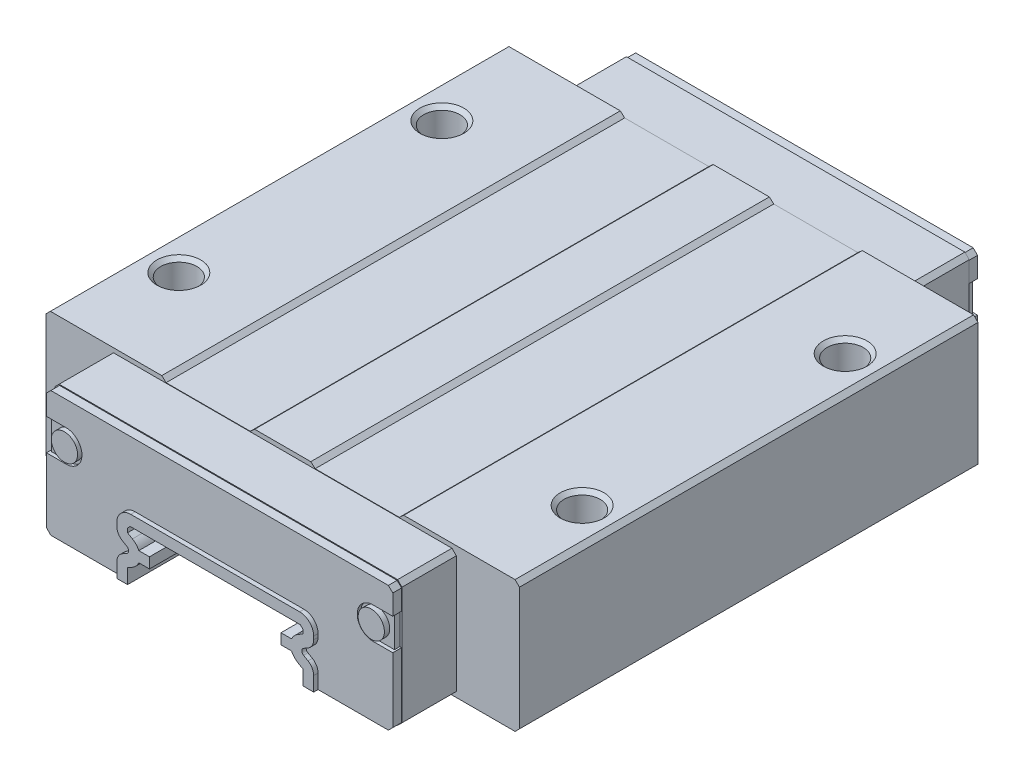
from build123d import *

# Parameters (mm, degrees)
BOSS_EXTRUDE1_DEPTH      = 26.15
BOSS_EXTRUDE1_DEPTH_BACK = 26.15
BOSS_EXTRUDE2_DEPTH      = 7.7
BOSS_EXTRUDE3_DEPTH      = 7.7
SKETCH4_W                = 108
SKETCH4_H                = 30
CUT_EXTRUDE1_DEPTH       = 1.5
SKETCH5_W                = 108
SKETCH5_H                = 30
CUT_EXTRUDE2_DEPTH       = 0.5
CUT_EXTRUDE3_START       = 1.5
SKETCH6_W                = 108
SKETCH6_H                = 30
CUT_EXTRUDE3_DEPTH       = 1.5
CUT_EXTRUDE4_START       = 0.5
SKETCH7_W                = 108
SKETCH7_H                = 30
CUT_EXTRUDE4_DEPTH       = 0.5
BOSS_EXTRUDE4_START      = 0.6
BOSS_EXTRUDE4_DEPTH      = 0.6
BOSS_EXTRUDE5_START      = 0.6
BOSS_EXTRUDE5_DEPTH      = 0.6
BOSS_EXTRUDE6_DEPTH      = 0.6
BOSS_EXTRUDE7_DEPTH      = 0.6
SKETCH12_W               = 0.6
SKETCH12_H               = 1.5
SKETCH13_W               = 0.6
SKETCH13_H               = 1.5
SKETCH14_W               = 0.6
SKETCH14_H               = 1.5
SKETCH15_W               = 0.6
SKETCH15_H               = 1.5
CUT_EXTRUDE5_DEPTH       = 26.15
CUT_EXTRUDE5_DEPTH_BACK  = 26.15
CUT_EXTRUDE6_DEPTH       = 26.15
SKETCH18_W               = 108
SKETCH18_H               = 30
CUT_EXTRUDE7_DEPTH       = 0.05
CUT_EXTRUDE8_START       = -26.15
CUT_EXTRUDE8_DEPTH       = 26.15
CUT_EXTRUDE9_START       = -0.05
SKETCH20_W               = 108
SKETCH20_H               = 30
CUT_EXTRUDE9_DEPTH       = 0.05


with BuildPart() as part:
    # Sketch1 → Boss-Extrude1 (new, two sides: drawn at the far end of the back side and taken through both)
    with BuildSketch(Plane.XY.offset(-BOSS_EXTRUDE1_DEPTH_BACK)):
        Polygon((-27, 19.5), (-27, 5.5), (-26.5, 5), (-14.47225, 5), (-14.257799308, 5.1), (14.257799308, 5.1), (14.47225, 5), (26.5, 5), (27, 5.5), (27, 19.5), (26.5, 20), (13.8, 20), (13.3, 19.55), (3.7, 19.55), (3.2, 20), (-3.2, 20), (-3.7, 19.55), (-13.3, 19.55), (-13.8, 20), (-26.5, 20), align=None)
    extrude(amount=BOSS_EXTRUDE1_DEPTH + BOSS_EXTRUDE1_DEPTH_BACK)

    # Sketch2 → Boss-Extrude2 (add)
    with BuildSketch(Plane.XY.offset(26.15)):
        Polygon((-19.8, 5.6), (-19.3, 5.1), (19.3, 5.1), (19.8, 5.6), (19.8, 19), (19.3, 19.5), (-19.3, 19.5), (-19.8, 19), align=None)
    extrude(amount=BOSS_EXTRUDE2_DEPTH)

    # Sketch3 → Boss-Extrude3 (add)
    with BuildSketch(Plane.XY.offset(-26.15)):
        Polygon((-19.8, 5.6), (-19.3, 5.1), (19.3, 5.1), (19.8, 5.6), (19.8, 19), (19.3, 19.5), (-19.3, 19.5), (-19.8, 19), align=None)
    extrude(amount=-BOSS_EXTRUDE3_DEPTH)

    # Sketch4 → Cut-Extrude1 (cut)
    with BuildSketch(Plane.XY.offset(33.85)):
        with Locations((0, 15)):
            Rectangle(SKETCH4_W, SKETCH4_H)
        with BuildLine():
            Line((-19.75, 5.6), (-19.25, 5.1))
            Line((-19.25, 5.1), (19.25, 5.1))
            Line((19.25, 5.1), (19.75, 5.6))
            Line((19.75, 5.6), (19.75, 13))
            Line((19.75, 13), (17.5, 13))
            ThreePointArc((17.5, 13), (15.7, 14.8), (17.5, 16.6))
            Line((17.5, 16.6), (19.75, 16.6))
            Line((19.75, 16.6), (19.75, 18.9))
            Line((19.75, 18.9), (19.25, 19.4))
            Line((19.25, 19.4), (-19.25, 19.4))
            Line((-19.25, 19.4), (-19.75, 18.9))
            Line((-19.75, 18.9), (-19.75, 16.6))
            Line((-19.75, 16.6), (-17.5, 16.6))
            ThreePointArc((-17.5, 16.6), (-15.7, 14.8), (-17.5, 13))
            Line((-17.5, 13), (-19.75, 13))
            Line((-19.75, 13), (-19.75, 5.6))
        make_face(mode=Mode.SUBTRACT)
    extrude(amount=-CUT_EXTRUDE1_DEPTH, mode=Mode.SUBTRACT)

    # Sketch5 → Cut-Extrude2 (cut)
    with BuildSketch(Plane.XY.offset(33.85)):
        with Locations((0, 15)):
            Rectangle(SKETCH5_W, SKETCH5_H)
        with BuildLine():
            Line((-11.23, 5.1), (11.23, 5.1))
            Line((11.23, 5.1), (11.23, 6.7357))
            ThreePointArc((11.23, 6.7357), (11.055848949, 7.385672418), (10.580055163, 7.861501175))
            Line((10.580055163, 7.861501175), (10.074183027, 8.153599638))
            ThreePointArc((10.074183027, 8.153599638), (9.8742, 8.5), (10.074183027, 8.846400362))
            Line((10.074183027, 8.846400362), (10.580055163, 9.138498825))
            ThreePointArc((10.580055163, 9.138498825), (11.055848949, 9.614327582), (11.23, 10.2643))
            Line((11.23, 10.2643), (11.23, 10.63))
            ThreePointArc((11.23, 10.63), (10.76137085, 11.76137085), (9.63, 12.23))
            Line((9.63, 12.23), (-9.63, 12.23))
            ThreePointArc((-9.63, 12.23), (-10.76137085, 11.76137085), (-11.23, 10.63))
            Line((-11.23, 10.63), (-11.23, 10.2643))
            ThreePointArc((-11.23, 10.2643), (-11.055848949, 9.614327582), (-10.580055163, 9.138498825))
            Line((-10.580055163, 9.138498825), (-10.074183027, 8.846400362))
            ThreePointArc((-10.074183027, 8.846400362), (-9.8742, 8.5), (-10.074183027, 8.153599638))
            Line((-10.074183027, 8.153599638), (-10.580055163, 7.861501175))
            ThreePointArc((-10.580055163, 7.861501175), (-11.055848949, 7.385672418), (-11.23, 6.7357))
            Line((-11.23, 6.7357), (-11.23, 5.1))
        make_face(mode=Mode.SUBTRACT)
    extrude(amount=-CUT_EXTRUDE2_DEPTH, mode=Mode.SUBTRACT)

    # Sketch6 → Cut-Extrude3 (cut)
    with BuildSketch(Plane.XY.offset(-33.85).offset(CUT_EXTRUDE3_START)):
        with Locations((0, 15)):
            Rectangle(SKETCH6_W, SKETCH6_H)
        with BuildLine():
            Line((-19.75, 5.6), (-19.25, 5.1))
            Line((-19.25, 5.1), (19.25, 5.1))
            Line((19.25, 5.1), (19.75, 5.6))
            Line((19.75, 5.6), (19.75, 13))
            Line((19.75, 13), (17.5, 13))
            ThreePointArc((17.5, 13), (15.7, 14.8), (17.5, 16.6))
            Line((17.5, 16.6), (19.75, 16.6))
            Line((19.75, 16.6), (19.75, 18.9))
            Line((19.75, 18.9), (19.25, 19.4))
            Line((19.25, 19.4), (-19.25, 19.4))
            Line((-19.25, 19.4), (-19.75, 18.9))
            Line((-19.75, 18.9), (-19.75, 16.6))
            Line((-19.75, 16.6), (-17.5, 16.6))
            ThreePointArc((-17.5, 16.6), (-15.7, 14.8), (-17.5, 13))
            Line((-17.5, 13), (-19.75, 13))
            Line((-19.75, 13), (-19.75, 5.6))
        make_face(mode=Mode.SUBTRACT)
    extrude(amount=-CUT_EXTRUDE3_DEPTH, mode=Mode.SUBTRACT)

    # Sketch7 → Cut-Extrude4 (cut)
    with BuildSketch(Plane.XY.offset(-33.85).offset(CUT_EXTRUDE4_START)):
        with Locations((0, 15)):
            Rectangle(SKETCH7_W, SKETCH7_H)
        with BuildLine():
            Line((-11.23, 5.1), (11.23, 5.1))
            Line((11.23, 5.1), (11.23, 6.7357))
            ThreePointArc((11.23, 6.7357), (11.055848949, 7.385672418), (10.580055163, 7.861501175))
            Line((10.580055163, 7.861501175), (10.074183027, 8.153599638))
            ThreePointArc((10.074183027, 8.153599638), (9.8742, 8.5), (10.074183027, 8.846400362))
            Line((10.074183027, 8.846400362), (10.580055163, 9.138498825))
            ThreePointArc((10.580055163, 9.138498825), (11.055848949, 9.614327582), (11.23, 10.2643))
            Line((11.23, 10.2643), (11.23, 10.63))
            ThreePointArc((11.23, 10.63), (10.76137085, 11.76137085), (9.63, 12.23))
            Line((9.63, 12.23), (-9.63, 12.23))
            ThreePointArc((-9.63, 12.23), (-10.76137085, 11.76137085), (-11.23, 10.63))
            Line((-11.23, 10.63), (-11.23, 10.2643))
            ThreePointArc((-11.23, 10.2643), (-11.055848949, 9.614327582), (-10.580055163, 9.138498825))
            Line((-10.580055163, 9.138498825), (-10.074183027, 8.846400362))
            ThreePointArc((-10.074183027, 8.846400362), (-9.8742, 8.5), (-10.074183027, 8.153599638))
            Line((-10.074183027, 8.153599638), (-10.580055163, 7.861501175))
            ThreePointArc((-10.580055163, 7.861501175), (-11.055848949, 7.385672418), (-11.23, 6.7357))
            Line((-11.23, 6.7357), (-11.23, 5.1))
        make_face(mode=Mode.SUBTRACT)
    extrude(amount=-CUT_EXTRUDE4_DEPTH, mode=Mode.SUBTRACT)

    # Sketch8 → Boss-Extrude4 (add)
    with BuildSketch(Plane.XY.offset(32.35).offset(BOSS_EXTRUDE4_START)):
        with BuildLine():
            Line((-19.55, 13), (-17.5, 13))
            ThreePointArc((-17.5, 13), (-15.7, 14.8), (-17.5, 16.6))
            Line((-17.5, 16.6), (-19.55, 16.6))
            Line((-19.55, 16.6), (-19.55, 13))
        make_face()
    extrude(amount=-BOSS_EXTRUDE4_DEPTH)

    # Sketch9 → Boss-Extrude5 (add)
    with BuildSketch(Plane.XY.offset(32.35).offset(BOSS_EXTRUDE5_START)):
        with BuildLine():
            Line((17.5, 13), (19.55, 13))
            Line((19.55, 13), (19.55, 16.6))
            Line((19.55, 16.6), (17.5, 16.6))
            ThreePointArc((17.5, 16.6), (15.7, 14.8), (17.5, 13))
        make_face()
    extrude(amount=-BOSS_EXTRUDE5_DEPTH)

    # Sketch10 → Boss-Extrude6 (add)
    with BuildSketch(Plane.XY.offset(-32.35)):
        with BuildLine():
            Line((-19.55, 13), (-17.5, 13))
            ThreePointArc((-17.5, 13), (-15.7, 14.8), (-17.5, 16.6))
            Line((-17.5, 16.6), (-19.55, 16.6))
            Line((-19.55, 16.6), (-19.55, 13))
        make_face()
    extrude(amount=-BOSS_EXTRUDE6_DEPTH)

    # Sketch11 → Boss-Extrude7 (add)
    with BuildSketch(Plane.XY.offset(-32.35)):
        with BuildLine():
            Line((17.5, 13), (19.55, 13))
            Line((19.55, 13), (19.55, 16.6))
            Line((19.55, 16.6), (17.5, 16.6))
            ThreePointArc((17.5, 16.6), (15.7, 14.8), (17.5, 13))
        make_face()
    extrude(amount=-BOSS_EXTRUDE7_DEPTH)

    # Sketch12 → Revolve1 (revolve)
    with BuildSketch(Plane(origin=(-17.5, 0, 0), x_dir=(0, 0, -1), z_dir=(1, 0, 0))):
        with Locations((-33.25, 15.55)):
            Rectangle(SKETCH12_W, SKETCH12_H)
    revolve(axis=Axis((-17.5, 14.8, 32.95), (0, 0, 1)))

    # Sketch13 → Revolve2 (revolve)
    with BuildSketch(Plane(origin=(-17.5, 0, 0), x_dir=(0, 0, -1), z_dir=(1, 0, 0))):
        with Locations((33.25, 15.55)):
            Rectangle(SKETCH13_W, SKETCH13_H)
    revolve(axis=Axis((-17.5, 14.8, -33.55), (0, 0, 1)))

    # Sketch14 → Revolve3 (revolve)
    with BuildSketch(Plane(origin=(17.5, 0, 0), x_dir=(0, 0, -1), z_dir=(1, 0, 0))):
        with Locations((-33.25, 15.55)):
            Rectangle(SKETCH14_W, SKETCH14_H)
    revolve(axis=Axis((17.5, 14.8, 32.95), (0, 0, 1)))

    # Sketch15 → Revolve4 (revolve)
    with BuildSketch(Plane(origin=(17.5, 0, 0), x_dir=(0, 0, -1), z_dir=(1, 0, 0))):
        with Locations((33.25, 15.55)):
            Rectangle(SKETCH15_W, SKETCH15_H)
    revolve(axis=Axis((17.5, 14.8, -33.55), (0, 0, 1)))

    # Sketch16 → Cut-Extrude5 (cut, two sides: drawn at the far end of the back side and taken through both)
    with BuildSketch(Plane.XY.offset(-CUT_EXTRUDE5_DEPTH_BACK)):
        with BuildLine():
            Line((-10, 6.77615), (-10, 0.5))
            Line((-10, 0.5), (-9.5, 0))
            Line((-9.5, 0), (9.5, 0))
            Line((9.5, 0), (10, 0.5))
            Line((10, 0.5), (10, 6.77615))
            Line((10, 6.77615), (9.440021531, 7.099443113))
            ThreePointArc((9.440021531, 7.099443113), (9.015681976, 7.442706235), (8.71772889, 7.9))
            Line((8.71772889, 7.9), (7.5, 7.9))
            Line((7.5, 7.9), (7.5, 9.1))
            Line((7.5, 9.1), (8.71772889, 9.1))
            ThreePointArc((8.71772889, 9.1), (9.015681976, 9.557293765), (9.440021531, 9.900556887))
            Line((9.440021531, 9.900556887), (10, 10.22385))
            Line((10, 10.22385), (10, 10.7))
            Line((10, 10.7), (9.7, 11))
            Line((9.7, 11), (-9.7, 11))
            Line((-9.7, 11), (-10, 10.7))
            Line((-10, 10.7), (-10, 10.22385))
            Line((-10, 10.22385), (-9.440021531, 9.900556887))
            ThreePointArc((-9.440021531, 9.900556887), (-9.015681976, 9.557293765), (-8.71772889, 9.1))
            Line((-8.71772889, 9.1), (-7.5, 9.1))
            Line((-7.5, 9.1), (-7.5, 7.9))
            Line((-7.5, 7.9), (-8.71772889, 7.9))
            ThreePointArc((-8.71772889, 7.9), (-9.015681976, 7.442706235), (-9.440021531, 7.099443113))
            Line((-9.440021531, 7.099443113), (-10, 6.77615))
        make_face()
    extrude(amount=CUT_EXTRUDE5_DEPTH + CUT_EXTRUDE5_DEPTH_BACK, mode=Mode.SUBTRACT)

    # Sketch17 → Cut-Extrude6 (cut)
    with BuildSketch(Plane.XY.offset(26.15)):
        with BuildLine():
            Line((-10, 6.77615), (-10, 0.5))
            Line((-10, 0.5), (-9.5, 0))
            Line((-9.5, 0), (9.5, 0))
            Line((9.5, 0), (10, 0.5))
            Line((10, 0.5), (10, 6.77615))
            Line((10, 6.77615), (9.440021531, 7.099443113))
            ThreePointArc((9.440021531, 7.099443113), (9.015681976, 7.442706235), (8.71772889, 7.9))
            Line((8.71772889, 7.9), (7.5, 7.9))
            Line((7.5, 7.9), (7.5, 9.1))
            Line((7.5, 9.1), (8.71772889, 9.1))
            ThreePointArc((8.71772889, 9.1), (9.015681976, 9.557293765), (9.440021531, 9.900556887))
            Line((9.440021531, 9.900556887), (10, 10.22385))
            Line((10, 10.22385), (10, 10.7))
            Line((10, 10.7), (9.7, 11))
            Line((9.7, 11), (-9.7, 11))
            Line((-9.7, 11), (-10, 10.7))
            Line((-10, 10.7), (-10, 10.22385))
            Line((-10, 10.22385), (-9.440021531, 9.900556887))
            ThreePointArc((-9.440021531, 9.900556887), (-9.015681976, 9.557293765), (-8.71772889, 9.1))
            Line((-8.71772889, 9.1), (-7.5, 9.1))
            Line((-7.5, 9.1), (-7.5, 7.9))
            Line((-7.5, 7.9), (-8.71772889, 7.9))
            ThreePointArc((-8.71772889, 7.9), (-9.015681976, 7.442706235), (-9.440021531, 7.099443113))
            Line((-9.440021531, 7.099443113), (-10, 6.77615))
        make_face()
    extrude(amount=CUT_EXTRUDE6_DEPTH, mode=Mode.SUBTRACT)

    # Sketch18 → Cut-Extrude7 (cut)
    with BuildSketch(Plane.XY.offset(26.15)):
        with Locations((0, 15)):
            Rectangle(SKETCH18_W, SKETCH18_H)
        with BuildLine():
            Line((-19.8, 5.55), (-19.35, 5.1))
            Line((-19.35, 5.1), (-10.05, 5.1))
            Line((-10.05, 5.1), (-10.05, 6.82615))
            Line((-10.05, 6.82615), (-9.507408796, 7.119073382))
            ThreePointArc((-9.507408796, 7.119073382), (-9.058275119, 7.470167011), (-8.750463327, 7.95))
            Line((-8.750463327, 7.95), (-7.55, 7.95))
            Line((-7.55, 7.95), (-7.55, 9.05))
            Line((-7.55, 9.05), (-8.750463327, 9.05))
            ThreePointArc((-8.750463327, 9.05), (-9.058275119, 9.529832989), (-9.507408796, 9.880926618))
            Line((-9.507408796, 9.880926618), (-10.05, 10.17385))
            Line((-10.05, 10.17385), (-10.05, 10.75))
            Line((-10.05, 10.75), (-9.75, 11.05))
            Line((-9.75, 11.05), (9.75, 11.05))
            Line((9.75, 11.05), (10.05, 10.75))
            Line((10.05, 10.75), (10.05, 10.17385))
            Line((10.05, 10.17385), (9.507408796, 9.880926618))
            ThreePointArc((9.507408796, 9.880926618), (9.058275119, 9.529832989), (8.750463327, 9.05))
            Line((8.750463327, 9.05), (7.55, 9.05))
            Line((7.55, 9.05), (7.55, 7.95))
            Line((7.55, 7.95), (8.750463327, 7.95))
            ThreePointArc((8.750463327, 7.95), (9.058275119, 7.470167011), (9.507408796, 7.119073382))
            Line((9.507408796, 7.119073382), (10.05, 6.82615))
            Line((10.05, 6.82615), (10.05, 5.1))
            Line((10.05, 5.1), (19.35, 5.1))
            Line((19.35, 5.1), (19.8, 5.55))
            Line((19.8, 5.55), (19.8, 19.05))
            Line((19.8, 19.05), (19.35, 19.5))
            Line((19.35, 19.5), (-19.35, 19.5))
            Line((-19.35, 19.5), (-19.8, 19.05))
            Line((-19.8, 19.05), (-19.8, 5.55))
        make_face(mode=Mode.SUBTRACT)
    extrude(amount=CUT_EXTRUDE7_DEPTH, mode=Mode.SUBTRACT)

    # Sketch19 → Cut-Extrude8 (cut)
    with BuildSketch(Plane.XY.offset(-26.15).offset(CUT_EXTRUDE8_START)):
        with BuildLine():
            Line((-10, 6.77615), (-10, 0.5))
            Line((-10, 0.5), (-9.5, 0))
            Line((-9.5, 0), (9.5, 0))
            Line((9.5, 0), (10, 0.5))
            Line((10, 0.5), (10, 6.77615))
            Line((10, 6.77615), (9.440021531, 7.099443113))
            ThreePointArc((9.440021531, 7.099443113), (9.015681976, 7.442706235), (8.71772889, 7.9))
            Line((8.71772889, 7.9), (7.5, 7.9))
            Line((7.5, 7.9), (7.5, 9.1))
            Line((7.5, 9.1), (8.71772889, 9.1))
            ThreePointArc((8.71772889, 9.1), (9.015681976, 9.557293765), (9.440021531, 9.900556887))
            Line((9.440021531, 9.900556887), (10, 10.22385))
            Line((10, 10.22385), (10, 10.7))
            Line((10, 10.7), (9.7, 11))
            Line((9.7, 11), (-9.7, 11))
            Line((-9.7, 11), (-10, 10.7))
            Line((-10, 10.7), (-10, 10.22385))
            Line((-10, 10.22385), (-9.440021531, 9.900556887))
            ThreePointArc((-9.440021531, 9.900556887), (-9.015681976, 9.557293765), (-8.71772889, 9.1))
            Line((-8.71772889, 9.1), (-7.5, 9.1))
            Line((-7.5, 9.1), (-7.5, 7.9))
            Line((-7.5, 7.9), (-8.71772889, 7.9))
            ThreePointArc((-8.71772889, 7.9), (-9.015681976, 7.442706235), (-9.440021531, 7.099443113))
            Line((-9.440021531, 7.099443113), (-10, 6.77615))
        make_face()
    extrude(amount=CUT_EXTRUDE8_DEPTH, mode=Mode.SUBTRACT)

    # Sketch20 → Cut-Extrude9 (cut)
    with BuildSketch(Plane.XY.offset(-26.15).offset(CUT_EXTRUDE9_START)):
        with Locations((0, 15)):
            Rectangle(SKETCH20_W, SKETCH20_H)
        with BuildLine():
            Line((-19.8, 5.55), (-19.35, 5.1))
            Line((-19.35, 5.1), (-10.05, 5.1))
            Line((-10.05, 5.1), (-10.05, 6.82615))
            Line((-10.05, 6.82615), (-9.507408796, 7.119073382))
            ThreePointArc((-9.507408796, 7.119073382), (-9.058275119, 7.470167011), (-8.750463327, 7.95))
            Line((-8.750463327, 7.95), (-7.55, 7.95))
            Line((-7.55, 7.95), (-7.55, 9.05))
            Line((-7.55, 9.05), (-8.750463327, 9.05))
            ThreePointArc((-8.750463327, 9.05), (-9.058275119, 9.529832989), (-9.507408796, 9.880926618))
            Line((-9.507408796, 9.880926618), (-10.05, 10.17385))
            Line((-10.05, 10.17385), (-10.05, 10.75))
            Line((-10.05, 10.75), (-9.75, 11.05))
            Line((-9.75, 11.05), (9.75, 11.05))
            Line((9.75, 11.05), (10.05, 10.75))
            Line((10.05, 10.75), (10.05, 10.17385))
            Line((10.05, 10.17385), (9.507408796, 9.880926618))
            ThreePointArc((9.507408796, 9.880926618), (9.058275119, 9.529832989), (8.750463327, 9.05))
            Line((8.750463327, 9.05), (7.55, 9.05))
            Line((7.55, 9.05), (7.55, 7.95))
            Line((7.55, 7.95), (8.750463327, 7.95))
            ThreePointArc((8.750463327, 7.95), (9.058275119, 7.470167011), (9.507408796, 7.119073382))
            Line((9.507408796, 7.119073382), (10.05, 6.82615))
            Line((10.05, 6.82615), (10.05, 5.1))
            Line((10.05, 5.1), (19.35, 5.1))
            Line((19.35, 5.1), (19.8, 5.55))
            Line((19.8, 5.55), (19.8, 19.05))
            Line((19.8, 19.05), (19.35, 19.5))
            Line((19.35, 19.5), (-19.35, 19.5))
            Line((-19.35, 19.5), (-19.8, 19.05))
            Line((-19.8, 19.05), (-19.8, 5.55))
        make_face(mode=Mode.SUBTRACT)
    extrude(amount=CUT_EXTRUDE9_DEPTH, mode=Mode.SUBTRACT)

    # Sketch21 → Cut-Revolve1 (revolve, cut)
    with BuildSketch(Plane(origin=(-23, 0, 0), x_dir=(0, 0, -1), z_dir=(1, 0, 0))):
        Polygon((15, 20), (17.5, 20), (17.067, 19.567), (17.067, 5.433), (17.5, 5), (15, 5), align=None)
    revolve(axis=Axis((-23, 5, -15), (0, 1, 0)), mode=Mode.SUBTRACT)

    # Sketch22 → Cut-Revolve2 (revolve, cut)
    with BuildSketch(Plane(origin=(23, 0, 0), x_dir=(0, 0, -1), z_dir=(1, 0, 0))):
        Polygon((15, 20), (17.5, 20), (17.067, 19.567), (17.067, 5.433), (17.5, 5), (15, 5), align=None)
    revolve(axis=Axis((23, 5, -15), (0, 1, 0)), mode=Mode.SUBTRACT)

    # Sketch23 → Cut-Revolve3 (revolve, cut)
    with BuildSketch(Plane(origin=(-23, 0, 0), x_dir=(0, 0, -1), z_dir=(1, 0, 0))):
        Polygon((-15, 20), (-12.5, 20), (-12.933, 19.567), (-12.933, 5.433), (-12.5, 5), (-15, 5), align=None)
    revolve(axis=Axis((-23, 5, 15), (0, 1, 0)), mode=Mode.SUBTRACT)

    # Sketch24 → Cut-Revolve4 (revolve, cut)
    with BuildSketch(Plane(origin=(23, 0, 0), x_dir=(0, 0, -1), z_dir=(1, 0, 0))):
        Polygon((-15, 20), (-12.5, 20), (-12.933, 19.567), (-12.933, 5.433), (-12.5, 5), (-15, 5), align=None)
    revolve(axis=Axis((23, 5, 15), (0, 1, 0)), mode=Mode.SUBTRACT)


solid = part.part
